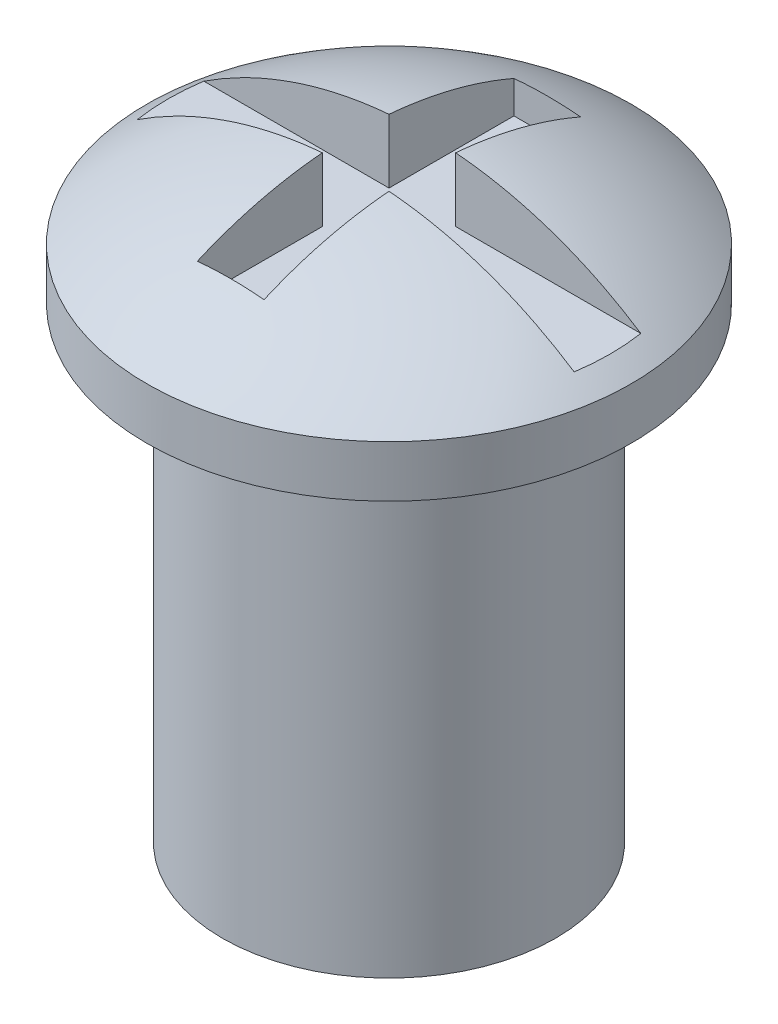
from build123d import *

# Parameters (mm, degrees)
SKETCH_1_R          = 2.5
EXTRUDE_1_DEPTH     = 7
SKETCH_2_R          = 3.635
EXTRUDE_2_DEPTH     = 2
SKETCH_3_W          = 10.772084644
SKETCH_3_H          = 1
CUT_EXTRUDE_1_DEPTH = 1
SKETCH_4_W          = 1
SKETCH_4_H          = 4.75
CUT_EXTRUDE_2_DEPTH = 1


with BuildPart() as part:
    # 草图1 → 拉伸1 (new body)
    with BuildSketch(Plane(origin=(0, 0, 0), x_dir=(1, 0, 0), z_dir=(0, 1, 0))):
        with Locations(Location((0, 0, 0), (0, 0, 270))):
            Circle(SKETCH_1_R)
    extrude(amount=EXTRUDE_1_DEPTH)

    # 草图2 → 拉伸2 (add)
    with BuildSketch(Plane(origin=(0, 7, 0), x_dir=(-1, 0, 0), z_dir=(0, 1, 0))):
        with Locations(Location((0, 0, 0), (0, 0, 90))):
            Circle(SKETCH_2_R)
    extrude(amount=EXTRUDE_2_DEPTH)

    # 草图3 → 切除-拉伸1 (cut)
    with BuildSketch(Plane(origin=(0, 9, 0), x_dir=(-1, 0, 0), z_dir=(0, 1, 0))):
        Rectangle(SKETCH_3_W, SKETCH_3_H)
    extrude(amount=-CUT_EXTRUDE_1_DEPTH, mode=Mode.SUBTRACT)

    # 草图4 → 切除-拉伸2 (cut)
    with BuildSketch(Plane(origin=(0, 9, 0), x_dir=(-1, 0, 0), z_dir=(0, 1, 0))):
        Rectangle(SKETCH_4_W, SKETCH_4_H)
    extrude(amount=-CUT_EXTRUDE_2_DEPTH, mode=Mode.SUBTRACT)

    # 草图5 → 切除-旋转16 (revolve, cut)
    with BuildSketch(Plane(origin=(0, 0, 0), x_dir=(0, 0, -1), z_dir=(1, 0, 0)), mode=Mode.PRIVATE) as cut_revolve_16_sk:
        with BuildLine():
            Line((0, 10.999822694), (-4.5493707, 10.999822694))
            Line((-4.5493707, 10.999822694), (-4.5493707, 6.911933822))
            ThreePointArc((-4.5493707, 6.911933822), (-2.502838096, 8.453054325), (0, 9))
            Line((0, 9), (0, 10.999822694))
        make_face()
    revolve(cut_revolve_16_sk.sketch.rotate(Axis((0, -2.105917543, 0), (0, 1, 0)), 180), axis=Axis((0, -2.105917543, 0), (0, 1, 0)), mode=Mode.SUBTRACT)


solid = part.part
